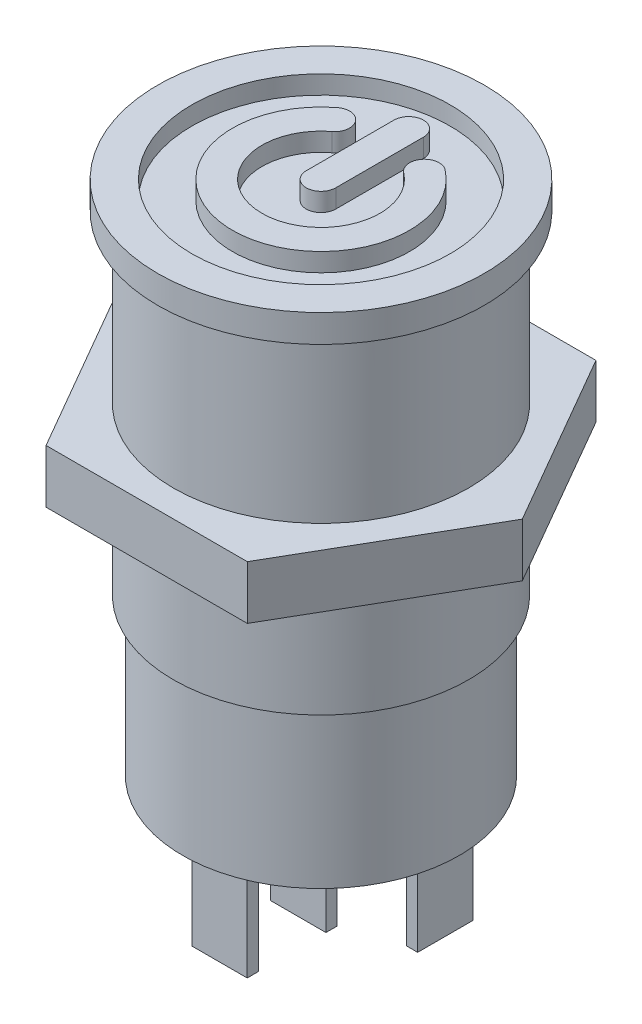
from build123d import *

# Parameters (mm, degrees)
ESQUISSE1_R             = 8
BOSS_EXTRU_1_DEPTH      = 18
ESQUISSE2_R             = 8.85
BOSS_EXTRU_2_DEPTH      = 1.5
ESQUISSE3_R             = 7
ENL_V_MAT_EXTRU_1_DEPTH = 1
ESQUISSE4_R             = 7.5
BOSS_EXTRU_3_DEPTH      = 8.5
ESQUISSE5_W             = 0.6
ESQUISSE5_H             = 3
ESQUISSE5_W_2           = 3
ESQUISSE5_H_2           = 0.6
BOSS_EXTRU_4_DEPTH      = 6
BOSS_EXTRU_5_START      = 9
BOSS_EXTRU_5_DEPTH      = 2.9


with BuildPart() as part:
    # Esquisse1 → Boss.-Extru.1 (new body)
    with BuildSketch(Plane(origin=(0, 0, 0), x_dir=(1, 0, 0), z_dir=(0, 1, 0))):
        with Locations(Location((0, 0, 0), (0, 0, 270))):
            Circle(ESQUISSE1_R)
    extrude(amount=-BOSS_EXTRU_1_DEPTH)

    # Esquisse2 → Boss.-Extru.2 (add)
    with BuildSketch(Plane(origin=(0, 0, 0), x_dir=(1, 0, 0), z_dir=(0, 1, 0))):
        with Locations(Location((0, 0, 0), (0, 0, 270))):
            Circle(ESQUISSE2_R)
    extrude(amount=BOSS_EXTRU_2_DEPTH)

    # Esquisse3 → Enlèv. mat.-Extru.1 (cut)
    with BuildSketch(Plane(origin=(0, 1.5, 0), x_dir=(1, 0, 0), z_dir=(0, 1, 0))):
        with Locations(Location((0, 0, 0), (0, 0, 270))):
            Circle(ESQUISSE3_R)
        with BuildLine():
            Line((-0.8, 0), (-0.8, 4.75466628))
            ThreePointArc((-0.8, 4.75466628), (0, 5.55466628), (0.8, 4.75466628))
            Line((0.8, 4.75466628), (0.8, 0))
            ThreePointArc((0.8, 0), (0, -0.8), (-0.8, 0))
        make_face(mode=Mode.SUBTRACT)
        with BuildLine():
            ThreePointArc((-2.913082643, 3.814963894), (0, -4.8), (2.913082643, 3.814963894))
            ThreePointArc((2.913082643, 3.814963894), (1.791741554, 3.664650352), (1.942055095, 2.543309263))
            ThreePointArc((1.942055095, 2.543309263), (0, -3.2), (-1.942055095, 2.543309263))
            ThreePointArc((-1.942055095, 2.543309263), (-1.791741554, 3.664650352), (-2.913082643, 3.814963894))
        make_face(mode=Mode.SUBTRACT)
    extrude(amount=-ENL_V_MAT_EXTRU_1_DEPTH, mode=Mode.SUBTRACT)

    # Esquisse4 → Boss.-Extru.3 (add)
    with BuildSketch(Plane.XZ.offset(18)):
        with Locations(Location((0, 0, 0), (0, 0, 270))):
            Circle(ESQUISSE4_R)
    extrude(amount=BOSS_EXTRU_3_DEPTH)

    # Esquisse5 → Boss.-Extru.4 (add)
    with BuildSketch(Plane.XZ.offset(26.5)):
        with Locations((-4.616296437, -1.823639602)):
            Rectangle(ESQUISSE5_W, ESQUISSE5_H)
        with Locations((0, 5.19973439)):
            Rectangle(ESQUISSE5_W_2, ESQUISSE5_H_2)
        with Locations((4.616296437, -1.823639602)):
            Rectangle(ESQUISSE5_W, ESQUISSE5_H)
        with Locations((0, 0.93263523)):
            Rectangle(ESQUISSE5_W_2, ESQUISSE5_H_2)
        with Locations((-0.5, -5.623689166)):
            Rectangle(ESQUISSE5_W_2, ESQUISSE5_H_2)
    extrude(amount=BOSS_EXTRU_4_DEPTH)

    # Esquisse6 → Boss.-Extru.5 (add)
    with BuildSketch(Plane.XZ.offset(BOSS_EXTRU_5_START)):
        Polygon((10.911920088, 0), (5.455960044, 9.45), (-5.455960044, 9.45), (-10.911920088, 0), (-5.455960044, -9.45), (5.455960044, -9.45), align=None)
    extrude(amount=BOSS_EXTRU_5_DEPTH)


solid = part.part
